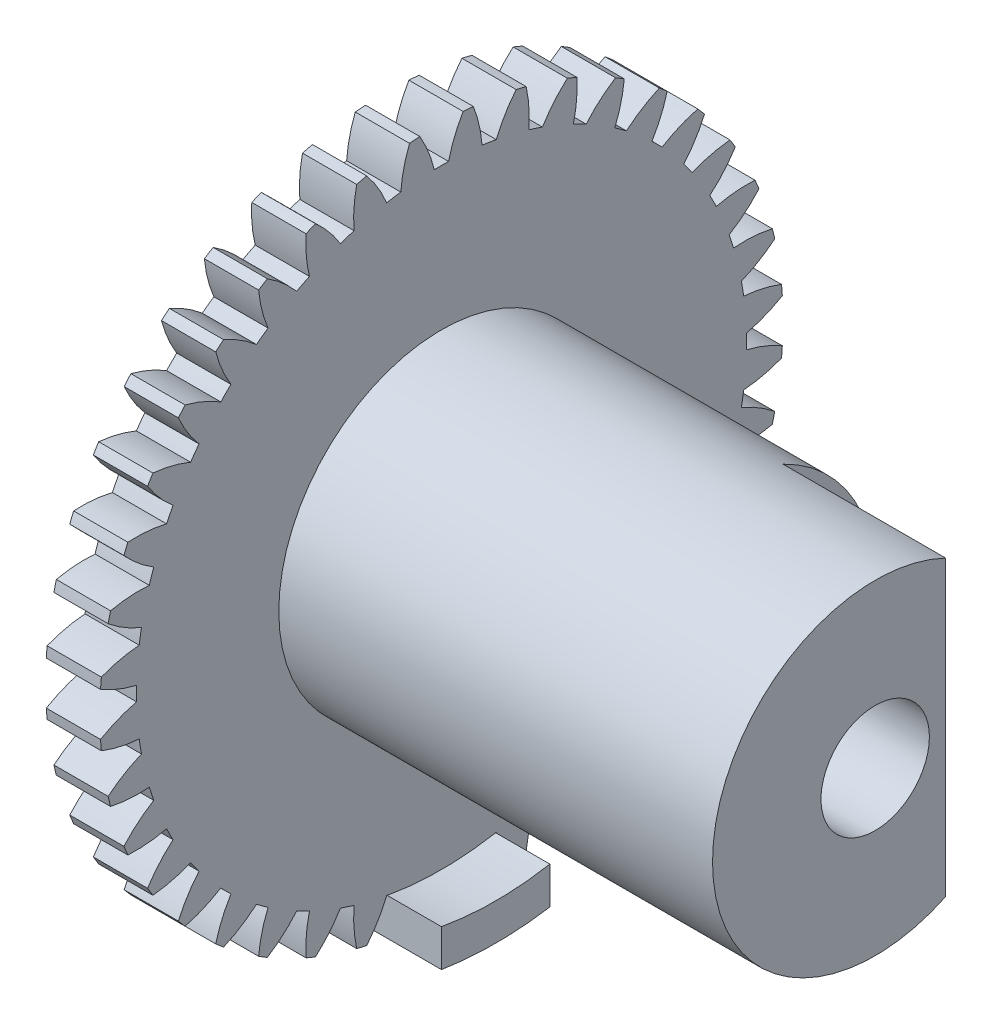
from build123d import *

# Parameters (mm, degrees)
BASPROSKE_W                  = 1
BASPROSKE_H                  = 6.3
TOOTHCUT_DEPTH               = 9.96548939
TEETHCUTS_COUNT              = 40
TEETHCUTS_ANGLE              = 351
BORSKE_R                     = 1
BORE_DEPTH                   = 50.0000508
ESTRUSIONE_ESTRUSIONE1_START = 8
SCHIZZO1_R                   = 3
SCHIZZO1_R_2                 = 1
ESTRUSIONE_ESTRUSIONE1_DEPTH = 8
TAGLIO_ESTRUSIONE2_DEPTH     = 3
ESTRUSIONE_ESTRUSIONE2_DEPTH = 2
ESTRUSIONE_ESTRUSIONE3_START = -3
SCHIZZO5_R                   = 1
ESTRUSIONE_ESTRUSIONE3_DEPTH = 1


with BuildPart() as part:
    # BasProSke → Base-Revolve (revolve)
    with BuildSketch(Plane(origin=(0, 0, 0), x_dir=(1, 0, 0), z_dir=(0, 1, 0)), mode=Mode.PRIVATE) as base_revolve_sk:
        with Locations((0.5, 3.15)):
            Rectangle(BASPROSKE_W, BASPROSKE_H)
    revolve(base_revolve_sk.sketch.rotate(Axis((-10, 0, 0), (1, 0, 0)), 180), axis=Axis((-10, 0, 0), (1, 0, 0)))

    # TooCutSke → ToothCut (cut, through all)
    with BuildSketch(Plane(origin=(0, 0, 0), x_dir=(0, 0, -1), z_dir=(1, 0, 0))):
        with BuildLine():
            ThreePointArc((0.132139403, 5.622447437), (0, 5.624), (-0.132139403, 5.622447437))
            ThreePointArc((-0.132139403, 5.622447437), (-0.246228658, 5.978143985), (-0.414130153, 6.311828687))
            ThreePointArc((-0.414130153, 6.311828687), (0, 6.3254), (0.414130153, 6.311828687))
            ThreePointArc((0.414130153, 6.311828687), (0.246228658, 5.978143985), (0.132139403, 5.622447437))
        make_face()
    toothcut = extrude(amount=TOOTHCUT_DEPTH, mode=Mode.SUBTRACT)

    # TeethCuts: ToothCut ×40 about axis
    teethcuts_axis = Axis((-10, 0, 0), (1, 0, 0))
    for i in range(1, TEETHCUTS_COUNT):
        add(toothcut.rotate(teethcuts_axis, i * TEETHCUTS_ANGLE / (TEETHCUTS_COUNT - 1)), mode=Mode.SUBTRACT)

    # BorSke → Bore (cut, symmetric)
    with BuildSketch(Plane(origin=(0, 0, 0), x_dir=(0, 0, -1), z_dir=(1, 0, 0))):
        with Locations(Location((0, 0, 0), (0, 0, 180))):
            Circle(BORSKE_R)
    extrude(amount=BORE_DEPTH, both=True, mode=Mode.SUBTRACT)

    # Schizzo1 → Estrusione-Estrusione1 (add)
    with BuildSketch(Plane(origin=(1, 0, 0), x_dir=(0, 0, -1), z_dir=(1, 0, 0)).offset(ESTRUSIONE_ESTRUSIONE1_START)):
        with Locations(Location((0, 0, 0), (0, 0, 180))):
            Circle(SCHIZZO1_R)
        Circle(SCHIZZO1_R_2, mode=Mode.SUBTRACT)
    extrude(amount=-ESTRUSIONE_ESTRUSIONE1_DEPTH)

    # Schizzo3 → Taglio-Estrusione2 (cut)
    with BuildSketch(Plane(origin=(9, 0, 0), x_dir=(0, 0, -1), z_dir=(1, 0, 0))):
        with BuildLine():
            Line((1.3, -2.703701167), (1.3, 2.703701167))
            ThreePointArc((1.3, 2.703701167), (3, 0), (1.3, -2.703701167))
        make_face()
    extrude(amount=-TAGLIO_ESTRUSIONE2_DEPTH, mode=Mode.SUBTRACT)

    # Schizzo4 → Estrusione-Estrusione2 (add)
    with BuildSketch(Plane.ZY):
        with BuildLine():
            Line((-1, -5.534381266), (-1, -6.220128616))
            ThreePointArc((-1, -6.220128616), (0, -6.3), (1, -6.220128616))
            Line((1, -6.220128616), (1, -5.534381266))
            ThreePointArc((1, -5.534381266), (0, -5.624), (-1, -5.534381266))
        make_face()
    extrude(amount=-ESTRUSIONE_ESTRUSIONE2_DEPTH)

    # Schizzo5 → Estrusione-Estrusione3 (add)
    with BuildSketch(Plane(origin=(9, 0, 0), x_dir=(0, 0, -1), z_dir=(1, 0, 0)).offset(ESTRUSIONE_ESTRUSIONE3_START)):
        Circle(SCHIZZO5_R)
    extrude(amount=-ESTRUSIONE_ESTRUSIONE3_DEPTH)


solid = part.part
